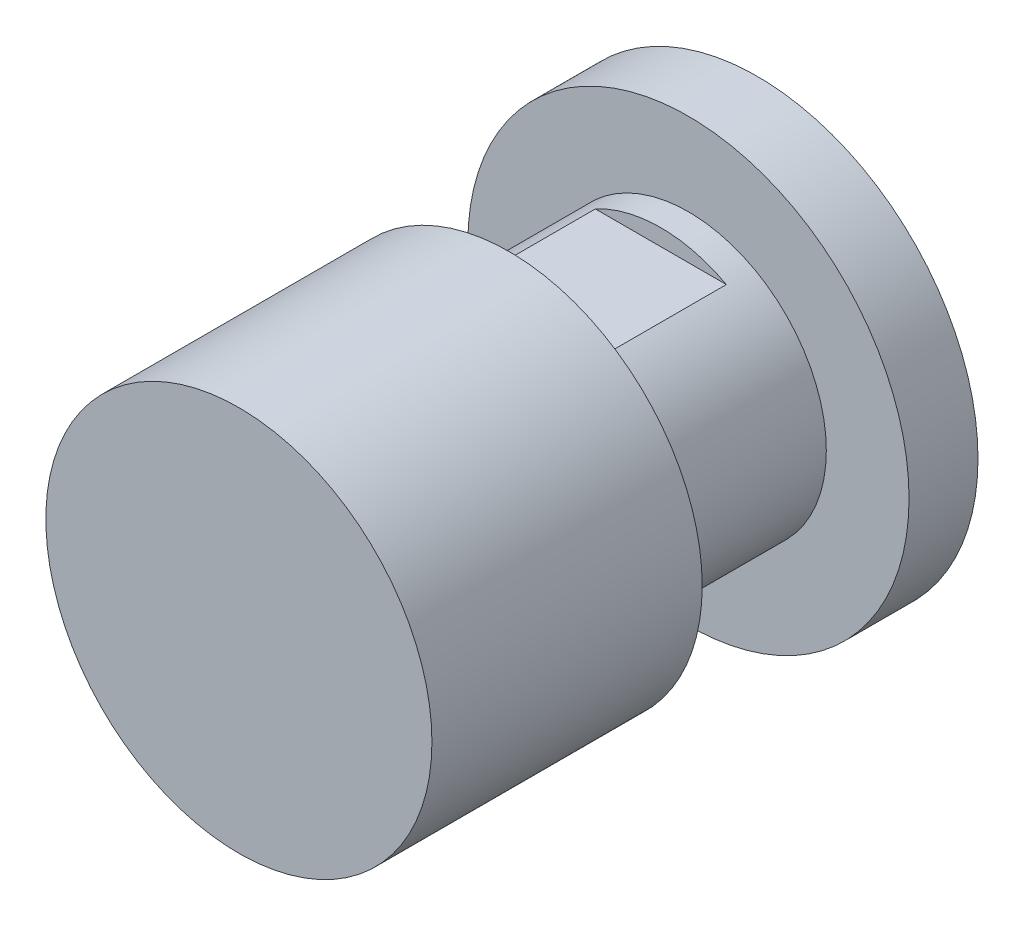
from build123d import *

# Parameters (mm, degrees)
SKETCH1_R           = 16
BOSS_EXTRUDE1_DEPTH = 5
SKETCH2_R           = 10
BOSS_EXTRUDE2_DEPTH = 24
SKETCH4_OUTSIDE_W   = 44.75
SKETCH4_OUTSIDE_H   = 44.75
SKETCH4_OUTSIDE_W_2 = 24
SKETCH4_OUTSIDE_H_2 = 17.6
CUT_EXTRUDE1_DEPTH  = 9
SKETCH5_R           = 14
BOSS_EXTRUDE3_DEPTH = 19.6


with BuildPart() as part:
    # Sketch1 → Boss-Extrude1 (new body)
    with BuildSketch(Plane.XY):
        Circle(SKETCH1_R)
    extrude(amount=BOSS_EXTRUDE1_DEPTH)

    # Sketch2 → Boss-Extrude2 (add)
    with BuildSketch(Plane.XY.offset(5)):
        Circle(SKETCH2_R)
    extrude(amount=BOSS_EXTRUDE2_DEPTH)

    # Sketch4 outside → Cut-Extrude1 (cut)
    with BuildSketch(Plane.XY.offset(7)):
        Rectangle(SKETCH4_OUTSIDE_W, SKETCH4_OUTSIDE_H)
        Rectangle(SKETCH4_OUTSIDE_W_2, SKETCH4_OUTSIDE_H_2, mode=Mode.SUBTRACT)
    extrude(amount=CUT_EXTRUDE1_DEPTH, mode=Mode.SUBTRACT)

    # Sketch5 → Boss-Extrude3 (add)
    with BuildSketch(Plane.XY.offset(18)):
        Circle(SKETCH5_R)
    extrude(amount=BOSS_EXTRUDE3_DEPTH)


solid = part.part
